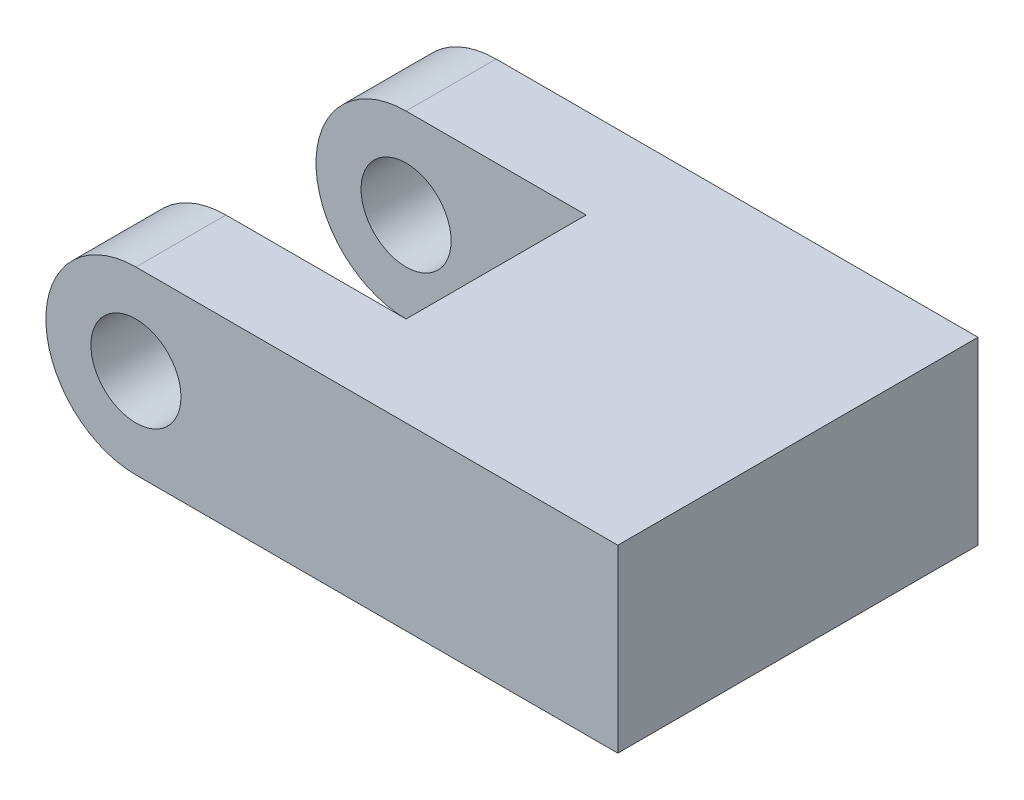
from build123d import *

# Parameters (mm, degrees)
SKETCH1_R               = 10
BOSS_EXTRUDE1_DEPTH     = 40
CUT_EXTRUDE1_DEPTH      = 20
CUT_EXTRUDE1_DEPTH_BACK = 40
SKETCH2_W               = 20
SKETCH2_H               = 28.944782362
SKETCH3_R               = 5
CUT_EXTRUDE3_DEPTH      = 40


with BuildPart() as part:
    # Sketch1 → Boss-Extrude1 (new body)
    with BuildSketch(Plane.XY):
        Circle(SKETCH1_R)
        with BuildLine():
            Line((53.512258846, 10), (0, 10))
            ThreePointArc((0, 10), (7.071067812, 7.071067812), (10, 0))
            ThreePointArc((10, 0), (7.071067812, -7.071067812), (0, -10))
            Line((0, -10), (53.512258846, -10))
            Line((53.512258846, -10), (53.512258846, 10))
        make_face()
    extrude(amount=BOSS_EXTRUDE1_DEPTH)

    # Sketch2 → Cut-Extrude1 (cut, two sides: drawn at the far end of the back side and taken through both)
    with BuildSketch(Plane(origin=(0, 0, 0), x_dir=(0, 0, -1), z_dir=(1, 0, 0)).offset(-CUT_EXTRUDE1_DEPTH_BACK)):
        with Locations((-20, 0)):
            Rectangle(SKETCH2_W, SKETCH2_H)
    extrude(amount=CUT_EXTRUDE1_DEPTH + CUT_EXTRUDE1_DEPTH_BACK, mode=Mode.SUBTRACT)

    # Sketch3 → Cut-Extrude3 (cut)
    with BuildSketch(Plane.XY.offset(40)):
        Circle(SKETCH3_R)
    extrude(amount=-CUT_EXTRUDE3_DEPTH, mode=Mode.SUBTRACT)


solid = part.part
